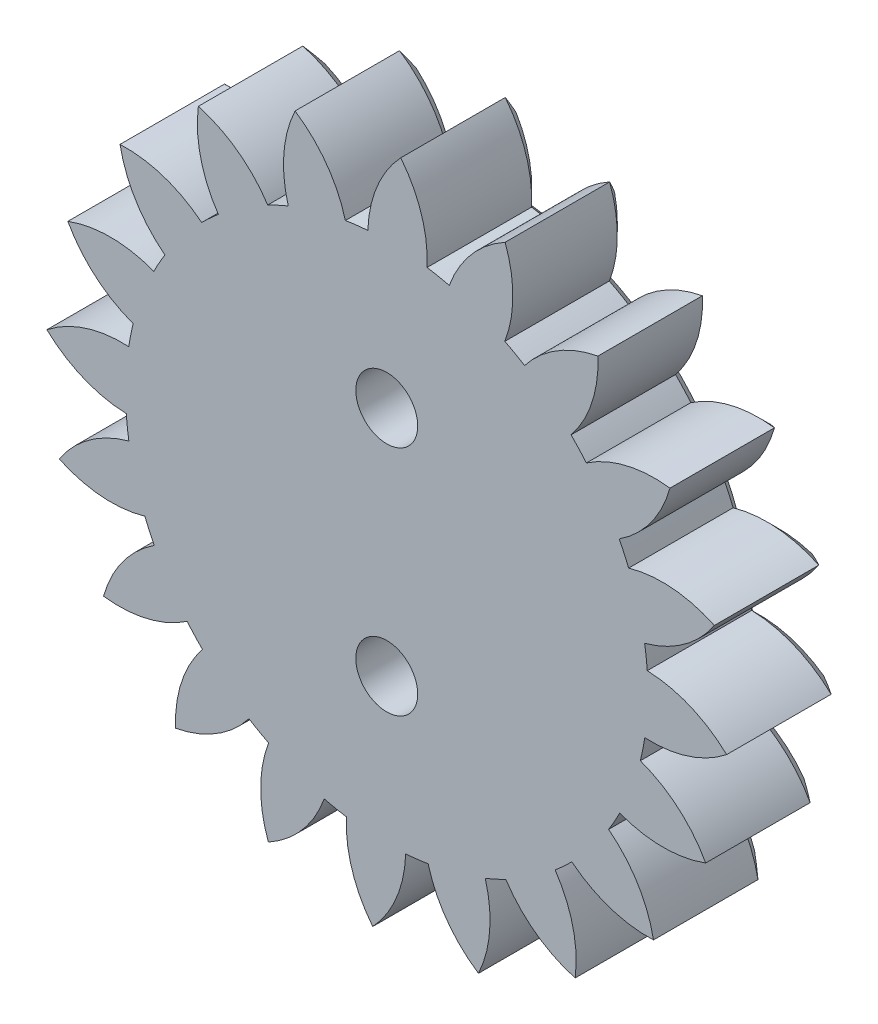
from build123d import *

# Parameters (mm, degrees)
EXTRUDE_4_DEPTH     = 3
CUT_EXTRUDE_1_REACH = 14.779
SKETCH_5_R          = 0.8
CHAMFER_1_SIZE      = 0.3


with BuildPart() as part:
    # 草图4 → 凸台-拉伸4 (new body)
    with BuildSketch(Plane.XY):
        with BuildLine():
            ThreePointArc((8.783435302, -0.362645816), (7.835197922, 0.250600785), (6.731331352, 0.488727051))
            ThreePointArc((6.731331352, 0.488727051), (6.703837213, 0.779899043), (6.663754039, 1.069606475))
            ThreePointArc((6.663754039, 1.069606475), (7.683474324, 1.554782796), (8.4656071, 2.369334111))
            ThreePointArc((8.4656071, 2.369334111), (7.374276139, 2.659544822), (6.250851581, 2.544902829))
            ThreePointArc((6.250851581, 2.544902829), (6.134726008, 2.813327694), (6.007080124, 3.076469452))
            ThreePointArc((6.007080124, 3.076469452), (6.826964017, 3.853010452), (7.319106291, 4.869387107))
            ThreePointArc((7.319106291, 4.869387107), (6.191508828, 4.808154082), (5.158494906, 4.351965787))
            ThreePointArc((5.158494906, 4.351965787), (4.965105077, 4.571368228), (4.762391352, 4.782186164))
            ThreePointArc((4.762391352, 4.782186164), (5.302182906, 5.774078599), (5.456160363, 6.892790566))
            ThreePointArc((5.456160363, 6.892790566), (4.402673493, 6.486107719), (3.561188807, 5.733028012))
            ThreePointArc((3.561188807, 5.733028012), (3.309465068, 5.881931389), (3.051526534, 6.019789176))
            ThreePointArc((3.051526534, 6.019789176), (3.258387189, 7.129939702), (3.059127444, 8.24147966))
            ThreePointArc((3.059127444, 8.24147966), (2.182873802, 7.529155942), (1.615288736, 6.55290151))
            ThreePointArc((1.615288736, 6.55290151), (1.329871559, 6.616730124), (1.041957037, 6.66813328))
            ThreePointArc((1.041957037, 6.66813328), (0.895637832, 7.78787263), (0.362645816, 8.783435302))
            ThreePointArc((0.362645816, 8.783435302), (-0.250600785, 7.835197922), (-0.488727051, 6.731331352))
            ThreePointArc((-0.488727051, 6.731331352), (-0.779899043, 6.703837213), (-1.069606475, 6.663754039))
            ThreePointArc((-1.069606475, 6.663754039), (-1.554782796, 7.683474324), (-2.369334111, 8.4656071))
            ThreePointArc((-2.369334111, 8.4656071), (-2.659544822, 7.374276139), (-2.544902829, 6.250851581))
            ThreePointArc((-2.544902829, 6.250851581), (-2.813327694, 6.134726008), (-3.076469452, 6.007080124))
            ThreePointArc((-3.076469452, 6.007080124), (-3.853010452, 6.826964017), (-4.869387107, 7.319106291))
            ThreePointArc((-4.869387107, 7.319106291), (-4.808154081, 6.191508828), (-4.351965787, 5.158494906))
            ThreePointArc((-4.351965787, 5.158494906), (-4.571368228, 4.965105077), (-4.782186164, 4.762391352))
            ThreePointArc((-4.782186164, 4.762391352), (-5.774078599, 5.302182906), (-6.892790566, 5.456160363))
            ThreePointArc((-6.892790566, 5.456160363), (-6.486107719, 4.402673493), (-5.733028012, 3.561188807))
            ThreePointArc((-5.733028012, 3.561188807), (-5.881931389, 3.309465068), (-6.019789175, 3.051526534))
            ThreePointArc((-6.019789175, 3.051526534), (-7.129939702, 3.258387189), (-8.24147966, 3.059127444))
            ThreePointArc((-8.24147966, 3.059127444), (-7.529155942, 2.182873802), (-6.55290151, 1.615288736))
            ThreePointArc((-6.55290151, 1.615288736), (-6.616730124, 1.329871559), (-6.66813328, 1.041957037))
            ThreePointArc((-6.66813328, 1.041957037), (-7.78787263, 0.895637832), (-8.783435302, 0.362645816))
            ThreePointArc((-8.783435302, 0.362645816), (-7.835197922, -0.250600785), (-6.731331352, -0.488727051))
            ThreePointArc((-6.731331352, -0.488727051), (-6.703837214, -0.779899043), (-6.663754039, -1.069606475))
            ThreePointArc((-6.663754039, -1.069606475), (-7.683474324, -1.554782796), (-8.4656071, -2.369334111))
            ThreePointArc((-8.4656071, -2.369334111), (-7.374276139, -2.659544822), (-6.250851581, -2.544902829))
            ThreePointArc((-6.250851581, -2.544902829), (-6.134726008, -2.813327694), (-6.007080124, -3.076469452))
            ThreePointArc((-6.007080124, -3.076469452), (-6.826964017, -3.853010452), (-7.319106291, -4.869387107))
            ThreePointArc((-7.319106291, -4.869387107), (-6.191508828, -4.808154082), (-5.158494906, -4.351965787))
            ThreePointArc((-5.158494906, -4.351965787), (-4.965105077, -4.571368228), (-4.762391352, -4.782186164))
            ThreePointArc((-4.762391352, -4.782186164), (-5.302182906, -5.774078599), (-5.456160363, -6.892790566))
            ThreePointArc((-5.456160363, -6.892790566), (-4.402673493, -6.486107719), (-3.561188807, -5.733028012))
            ThreePointArc((-3.561188807, -5.733028012), (-3.309465068, -5.881931389), (-3.051526534, -6.019789176))
            ThreePointArc((-3.051526534, -6.019789176), (-3.258387189, -7.129939702), (-3.059127444, -8.24147966))
            ThreePointArc((-3.059127444, -8.24147966), (-2.182873803, -7.529155942), (-1.615288736, -6.55290151))
            ThreePointArc((-1.615288736, -6.55290151), (-1.329871559, -6.616730125), (-1.041957037, -6.66813328))
            ThreePointArc((-1.041957037, -6.66813328), (-0.895637832, -7.78787263), (-0.362645816, -8.783435302))
            ThreePointArc((-0.362645816, -8.783435302), (0.250600785, -7.835197922), (0.488727051, -6.731331352))
            ThreePointArc((0.488727051, -6.731331352), (0.779899043, -6.703837213), (1.069606475, -6.663754039))
            ThreePointArc((1.069606475, -6.663754039), (1.554782796, -7.683474324), (2.369334111, -8.4656071))
            ThreePointArc((2.369334111, -8.4656071), (2.659544822, -7.374276139), (2.544902829, -6.250851581))
            ThreePointArc((2.544902829, -6.250851581), (2.813327694, -6.134726008), (3.076469452, -6.007080124))
            ThreePointArc((3.076469452, -6.007080124), (3.853010452, -6.826964017), (4.869387107, -7.319106291))
            ThreePointArc((4.869387107, -7.319106291), (4.808154082, -6.191508828), (4.351965787, -5.158494906))
            ThreePointArc((4.351965787, -5.158494906), (4.571368228, -4.965105077), (4.782186164, -4.762391352))
            ThreePointArc((4.782186164, -4.762391352), (5.774078599, -5.302182906), (6.892790566, -5.456160363))
            ThreePointArc((6.892790566, -5.456160363), (6.486107719, -4.402673493), (5.733028012, -3.561188807))
            ThreePointArc((5.733028012, -3.561188807), (5.881931389, -3.309465068), (6.019789176, -3.051526534))
            ThreePointArc((6.019789176, -3.051526534), (7.129939702, -3.258387189), (8.24147966, -3.059127444))
            ThreePointArc((8.24147966, -3.059127444), (7.529155942, -2.182873802), (6.55290151, -1.615288736))
            ThreePointArc((6.55290151, -1.615288736), (6.616730124, -1.329871559), (6.66813328, -1.041957037))
            ThreePointArc((6.66813328, -1.041957037), (7.78787263, -0.895637832), (8.783435302, -0.362645816))
        make_face()
    extrude(amount=EXTRUDE_4_DEPTH)

    # 草图5 → 切除-拉伸1 (cut, up to next)
    with BuildSketch(Plane(origin=(0, 0, 0), x_dir=(-1, 0, 0), z_dir=(0, 0, -1)), mode=Mode.PRIVATE) as cut_extrude_1_sk1:
        with Locations((0, 3)):
            Circle(SKETCH_5_R)
    cut_extrude_1_tool1 = extrude(cut_extrude_1_sk1.sketch, amount=-CUT_EXTRUDE_1_REACH, mode=Mode.PRIVATE) & part.part
    # 草图5 → 切除-拉伸1 (cut, up to next)
    with BuildSketch(Plane(origin=(0, 0, 0), x_dir=(-1, 0, 0), z_dir=(0, 0, -1)), mode=Mode.PRIVATE) as cut_extrude_1_sk2:
        with Locations((0, -3)):
            Circle(SKETCH_5_R)
    cut_extrude_1_tool2 = extrude(cut_extrude_1_sk2.sketch, amount=-CUT_EXTRUDE_1_REACH, mode=Mode.PRIVATE) & part.part
    add(cut_extrude_1_tool1.solids().sort_by_distance((0, 3, 0))[0], mode=Mode.SUBTRACT)
    add(cut_extrude_1_tool2.solids().sort_by_distance((0, -3, 0))[0], mode=Mode.SUBTRACT)

    # 倒角1
    chamfer_1_edges = [part.edges().sort_by_distance(p)[0] for p in [
        (0.8, 3, 0),
        (0.8, -3, 0),
        (6.616730124, -1.329871559, 0),
        (7.529155942, -2.182873802, 0),
        (7.129939702, -3.258387189, 0),
        (5.881931389, -3.309465068, 0),
        (6.486107719, -4.402673493, 0),
        (5.774078599, -5.302182906, 0),
        (4.571368228, -4.965105077, 0),
        (4.808154082, -6.191508828, 0),
        (3.853010452, -6.826964017, 0),
        (2.813327694, -6.134726008, 0),
        (2.659544822, -7.374276139, 0),
        (1.554782796, -7.683474324, 0),
        (0.779899043, -6.703837213, 0),
        (0.250600785, -7.835197922, 0),
        (-0.895637832, -7.78787263, 0),
        (-1.329871559, -6.616730125, 0),
        (-2.182873803, -7.529155942, 0),
        (-3.258387189, -7.129939702, 0),
        (-3.309465068, -5.881931389, 0),
        (-4.402673493, -6.486107719, 0),
        (-5.302182906, -5.774078599, 0),
        (-4.965105077, -4.571368228, 0),
        (-6.191508828, -4.808154082, 0),
        (-6.826964017, -3.853010452, 0),
        (-6.134726008, -2.813327694, 0),
        (-7.374276139, -2.659544822, 0),
        (-7.683474324, -1.554782796, 0),
        (-6.703837214, -0.779899043, 0),
        (-7.835197922, -0.250600785, 0),
        (-7.78787263, 0.895637832, 0),
        (-6.616730124, 1.329871559, 0),
        (-7.529155942, 2.182873802, 0),
        (-7.129939702, 3.258387189, 0),
        (-5.881931389, 3.309465068, 0),
        (-6.486107719, 4.402673493, 0),
        (-5.774078599, 5.302182906, 0),
        (-4.571368228, 4.965105077, 0),
        (-4.808154081, 6.191508828, 0),
        (-3.853010452, 6.826964017, 0),
        (-2.813327694, 6.134726008, 0),
        (-2.659544822, 7.374276139, 0),
        (-1.554782796, 7.683474324, 0),
        (-0.779899043, 6.703837213, 0),
        (-0.250600785, 7.835197922, 0),
        (0.895637832, 7.78787263, 0),
        (1.329871559, 6.616730124, 0),
        (2.182873802, 7.529155942, 0),
        (3.258387189, 7.129939702, 0),
        (3.309465068, 5.881931389, 0),
        (4.402673493, 6.486107719, 0),
        (5.302182906, 5.774078599, 0),
        (4.965105077, 4.571368228, 0),
        (6.191508828, 4.808154082, 0),
        (6.826964017, 3.853010452, 0),
        (6.134726008, 2.813327694, 0),
        (7.374276139, 2.659544822, 0),
        (7.683474324, 1.554782796, 0),
        (6.703837213, 0.779899043, 0),
        (7.835197922, 0.250600785, 0),
        (7.78787263, -0.895637832, 0),
    ]]
    chamfer(chamfer_1_edges, length=CHAMFER_1_SIZE)


solid = part.part
